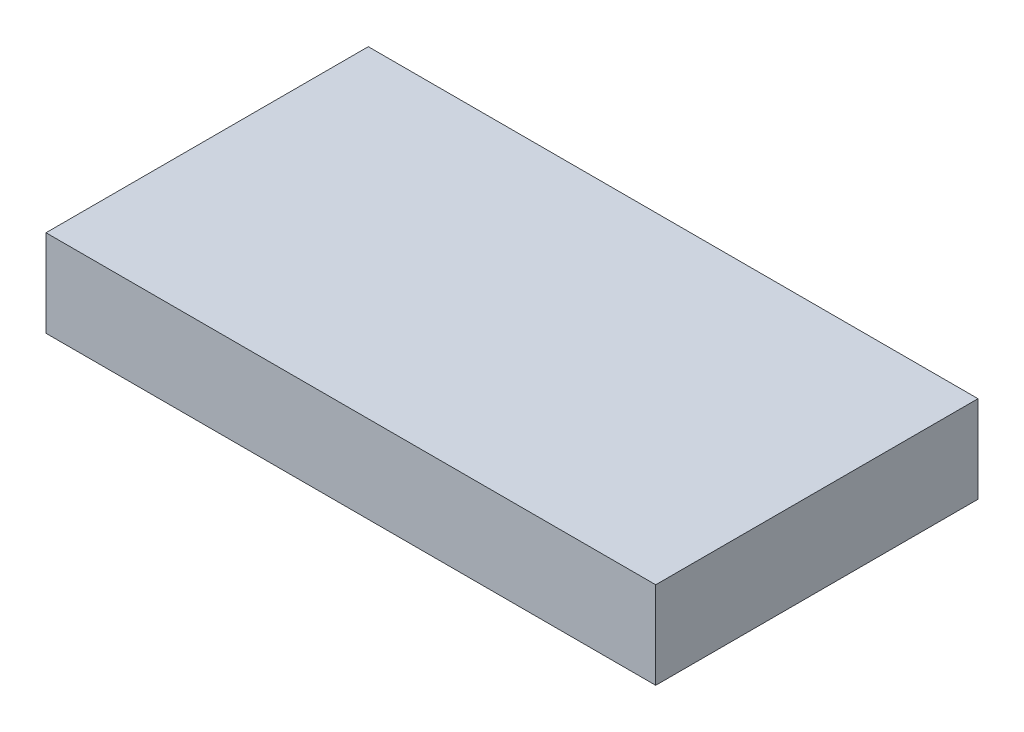
from build123d import *

# Parameters (mm, degrees)
SKETCH1_W           = 140
SKETCH1_H           = 74
BOSS_EXTRUDE1_DEPTH = 20


with BuildPart() as part:
    # Sketch1 → Boss-Extrude1 (new body)
    with BuildSketch(Plane(origin=(0, 0, 0), x_dir=(1, 0, 0), z_dir=(0, 1, 0))):
        with Locations((70, 37)):
            Rectangle(SKETCH1_W, SKETCH1_H)
    extrude(amount=BOSS_EXTRUDE1_DEPTH)


solid = part.part
